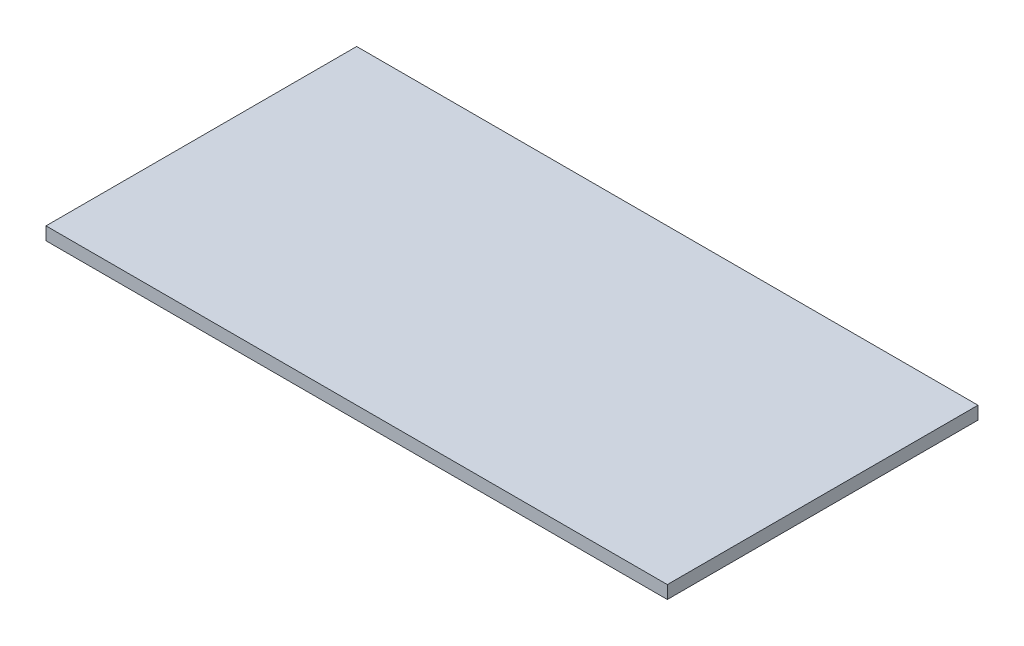
from build123d import *

# Parameters (mm, degrees)
SKETCH1_W           = 304.8
SKETCH1_H           = 152.4
BOSS_EXTRUDE1_DEPTH = 6.35


with BuildPart() as part:
    # Sketch1 → Boss-Extrude1 (new body)
    with BuildSketch(Plane(origin=(0, 0, 0), x_dir=(1, 0, 0), z_dir=(0, 1, 0))):
        Rectangle(SKETCH1_W, SKETCH1_H)
    extrude(amount=BOSS_EXTRUDE1_DEPTH)


solid = part.part
